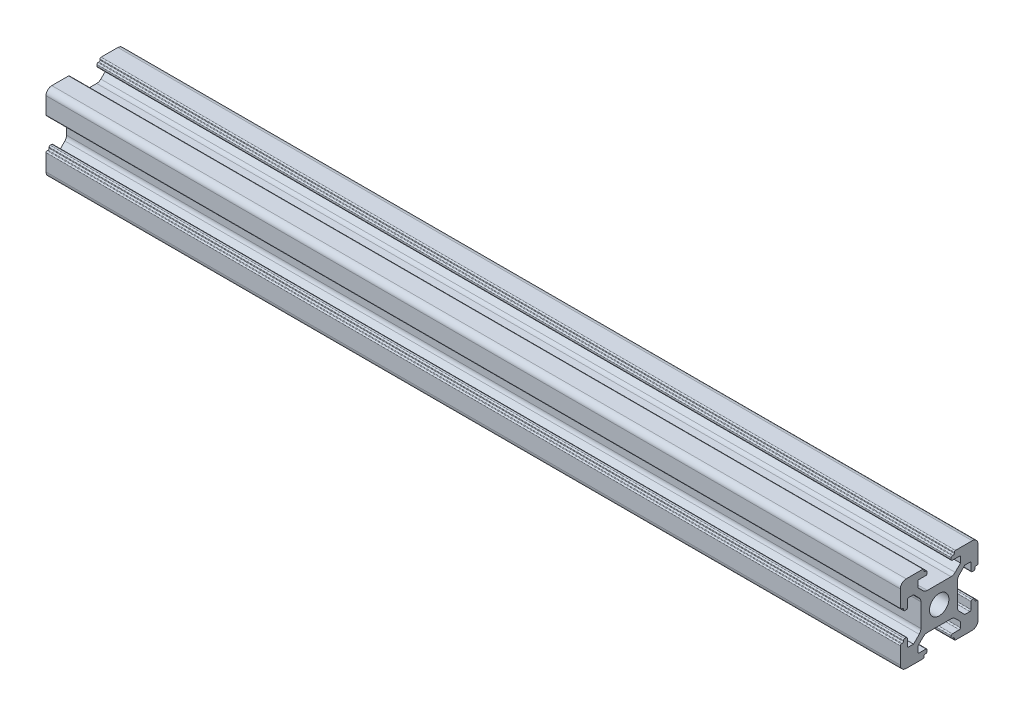
from build123d import *

# Parameters (mm, degrees)
SKETCH1_R           = 2.5
BOSS_EXTRUDE2_DEPTH = 110


with BuildPart() as part:
    # Sketch1 → Boss-Extrude2 (new, symmetric)
    with BuildSketch(Plane(origin=(0, 0, 0), x_dir=(0, 0, -1), z_dir=(1, 0, 0))):
        with BuildLine():
            Line((10, 4.2), (10, 8.5))
            ThreePointArc((10, 8.5), (9.560660172, 9.560660172), (8.5, 10))
            Line((8.5, 10), (4.2, 10))
            ThreePointArc((4.2, 10), (3.987867966, 9.912132034), (3.9, 9.7))
            Line((3.9, 9.7), (3.9, 9.5))
            ThreePointArc((3.9, 9.5), (3.812132034, 9.287867966), (3.6, 9.2))
            Line((3.6, 9.2), (3.4, 9.2))
            ThreePointArc((3.4, 9.2), (3.187867966, 9.112132034), (3.1, 8.9))
            Line((3.1, 8.9), (3.1, 8.5))
            ThreePointArc((3.1, 8.5), (3.187867966, 8.287867966), (3.4, 8.2))
            Line((3.4, 8.2), (5.2, 8.2))
            ThreePointArc((5.2, 8.2), (5.412132034, 8.112132034), (5.5, 7.9))
            Line((5.5, 7.9), (5.5, 6.521320344))
            Line((5.5, 6.521320344), (4.118019485, 5.139339828))
            ThreePointArc((4.118019485, 5.139339828), (3.631384461, 4.814180701), (3.057359313, 4.7))
            Line((3.057359313, 4.7), (-3.057359313, 4.7))
            ThreePointArc((-3.057359313, 4.7), (-3.631384461, 4.814180701), (-4.118019485, 5.139339828))
            Line((-4.118019485, 5.139339828), (-5.5, 6.521320344))
            Line((-5.5, 6.521320344), (-5.5, 7.9))
            ThreePointArc((-5.5, 7.9), (-5.412132034, 8.112132034), (-5.2, 8.2))
            Line((-5.2, 8.2), (-3.4, 8.2))
            ThreePointArc((-3.4, 8.2), (-3.187867966, 8.287867966), (-3.1, 8.5))
            Line((-3.1, 8.5), (-3.1, 8.9))
            ThreePointArc((-3.1, 8.9), (-3.187867966, 9.112132034), (-3.4, 9.2))
            Line((-3.4, 9.2), (-3.6, 9.2))
            ThreePointArc((-3.6, 9.2), (-3.812132034, 9.287867966), (-3.9, 9.5))
            Line((-3.9, 9.5), (-3.9, 9.7))
            ThreePointArc((-3.9, 9.7), (-3.987867966, 9.912132034), (-4.2, 10))
            Line((-4.2, 10), (-8.5, 10))
            ThreePointArc((-8.5, 10), (-9.560660172, 9.560660172), (-10, 8.5))
            Line((-10, 8.5), (-10, 4.2))
            ThreePointArc((-10, 4.2), (-9.912132034, 3.987867966), (-9.7, 3.9))
            Line((-9.7, 3.9), (-9.5, 3.9))
            ThreePointArc((-9.5, 3.9), (-9.287867966, 3.812132034), (-9.2, 3.6))
            Line((-9.2, 3.6), (-9.2, 3.4))
            ThreePointArc((-9.2, 3.4), (-9.112132034, 3.187867966), (-8.9, 3.1))
            Line((-8.9, 3.1), (-8.5, 3.1))
            ThreePointArc((-8.5, 3.1), (-8.287867966, 3.187867966), (-8.2, 3.4))
            Line((-8.2, 3.4), (-8.2, 5.2))
            ThreePointArc((-8.2, 5.2), (-8.112132034, 5.412132034), (-7.9, 5.5))
            Line((-7.9, 5.5), (-6.6, 5.5))
            Line((-6.6, 5.5), (-5.139339828, 4.039339828))
            ThreePointArc((-5.139339828, 4.039339828), (-4.814180701, 3.552704805), (-4.7, 2.978679656))
            Line((-4.7, 2.978679656), (-4.7, -2.978679656))
            ThreePointArc((-4.7, -2.978679656), (-4.814180701, -3.552704805), (-5.139339828, -4.039339828))
            Line((-5.139339828, -4.039339828), (-6.6, -5.5))
            Line((-6.6, -5.5), (-7.9, -5.5))
            ThreePointArc((-7.9, -5.5), (-8.112132034, -5.412132034), (-8.2, -5.2))
            Line((-8.2, -5.2), (-8.2, -3.4))
            ThreePointArc((-8.2, -3.4), (-8.287867966, -3.187867966), (-8.5, -3.1))
            Line((-8.5, -3.1), (-8.9, -3.1))
            ThreePointArc((-8.9, -3.1), (-9.112132034, -3.187867966), (-9.2, -3.4))
            Line((-9.2, -3.4), (-9.2, -3.6))
            ThreePointArc((-9.2, -3.6), (-9.287867966, -3.812132034), (-9.5, -3.9))
            Line((-9.5, -3.9), (-9.7, -3.9))
            ThreePointArc((-9.7, -3.9), (-9.912132034, -3.987867966), (-10, -4.2))
            Line((-10, -4.2), (-10, -8.5))
            ThreePointArc((-10, -8.5), (-9.560660172, -9.560660172), (-8.5, -10))
            Line((-8.5, -10), (-4.2, -10))
            ThreePointArc((-4.2, -10), (-3.987867966, -9.912132034), (-3.9, -9.7))
            Line((-3.9, -9.7), (-3.9, -9.5))
            ThreePointArc((-3.9, -9.5), (-3.812132034, -9.287867966), (-3.6, -9.2))
            Line((-3.6, -9.2), (-3.4, -9.2))
            ThreePointArc((-3.4, -9.2), (-3.187867966, -9.112132034), (-3.1, -8.9))
            Line((-3.1, -8.9), (-3.1, -8.5))
            ThreePointArc((-3.1, -8.5), (-3.187867966, -8.287867966), (-3.4, -8.2))
            Line((-3.4, -8.2), (-5.2, -8.2))
            ThreePointArc((-5.2, -8.2), (-5.412132034, -8.112132034), (-5.5, -7.9))
            Line((-5.5, -7.9), (-5.5, -6.521320344))
            Line((-5.5, -6.521320344), (-4.118019485, -5.139339828))
            ThreePointArc((-4.118019485, -5.139339828), (-3.631384461, -4.814180701), (-3.057359313, -4.7))
            Line((-3.057359313, -4.7), (3.057359313, -4.7))
            ThreePointArc((3.057359313, -4.7), (3.631384461, -4.814180701), (4.118019485, -5.139339828))
            Line((4.118019485, -5.139339828), (5.5, -6.521320344))
            Line((5.5, -6.521320344), (5.5, -7.9))
            ThreePointArc((5.5, -7.9), (5.412132034, -8.112132034), (5.2, -8.2))
            Line((5.2, -8.2), (3.4, -8.2))
            ThreePointArc((3.4, -8.2), (3.187867966, -8.287867966), (3.1, -8.5))
            Line((3.1, -8.5), (3.1, -8.9))
            ThreePointArc((3.1, -8.9), (3.187867966, -9.112132034), (3.4, -9.2))
            Line((3.4, -9.2), (3.6, -9.2))
            ThreePointArc((3.6, -9.2), (3.812132034, -9.287867966), (3.9, -9.5))
            Line((3.9, -9.5), (3.9, -9.7))
            ThreePointArc((3.9, -9.7), (3.987867966, -9.912132034), (4.2, -10))
            Line((4.2, -10), (8.5, -10))
            ThreePointArc((8.5, -10), (9.560660172, -9.560660172), (10, -8.5))
            Line((10, -8.5), (10, -4.2))
            ThreePointArc((10, -4.2), (9.912132034, -3.987867966), (9.7, -3.9))
            Line((9.7, -3.9), (9.5, -3.9))
            ThreePointArc((9.5, -3.9), (9.287867966, -3.812132034), (9.2, -3.6))
            Line((9.2, -3.6), (9.2, -3.4))
            ThreePointArc((9.2, -3.4), (9.112132034, -3.187867966), (8.9, -3.1))
            Line((8.9, -3.1), (8.5, -3.1))
            ThreePointArc((8.5, -3.1), (8.287867966, -3.187867966), (8.2, -3.4))
            Line((8.2, -3.4), (8.2, -5.2))
            ThreePointArc((8.2, -5.2), (8.112132034, -5.412132034), (7.9, -5.5))
            Line((7.9, -5.5), (6.6, -5.5))
            Line((6.6, -5.5), (5.139339828, -4.039339828))
            ThreePointArc((5.139339828, -4.039339828), (4.814180701, -3.552704805), (4.7, -2.978679656))
            Line((4.7, -2.978679656), (4.7, 2.978679656))
            ThreePointArc((4.7, 2.978679656), (4.814180701, 3.552704805), (5.139339828, 4.039339828))
            Line((5.139339828, 4.039339828), (6.6, 5.5))
            Line((6.6, 5.5), (7.9, 5.5))
            ThreePointArc((7.9, 5.5), (8.112132034, 5.412132034), (8.2, 5.2))
            Line((8.2, 5.2), (8.2, 3.4))
            ThreePointArc((8.2, 3.4), (8.287867966, 3.187867966), (8.5, 3.1))
            Line((8.5, 3.1), (8.9, 3.1))
            ThreePointArc((8.9, 3.1), (9.112132034, 3.187867966), (9.2, 3.4))
            Line((9.2, 3.4), (9.2, 3.6))
            ThreePointArc((9.2, 3.6), (9.287867966, 3.812132034), (9.5, 3.9))
            Line((9.5, 3.9), (9.7, 3.9))
            ThreePointArc((9.7, 3.9), (9.912132034, 3.987867966), (10, 4.2))
        make_face()
        Circle(SKETCH1_R, mode=Mode.SUBTRACT)
    extrude(amount=BOSS_EXTRUDE2_DEPTH, both=True)


solid = part.part
